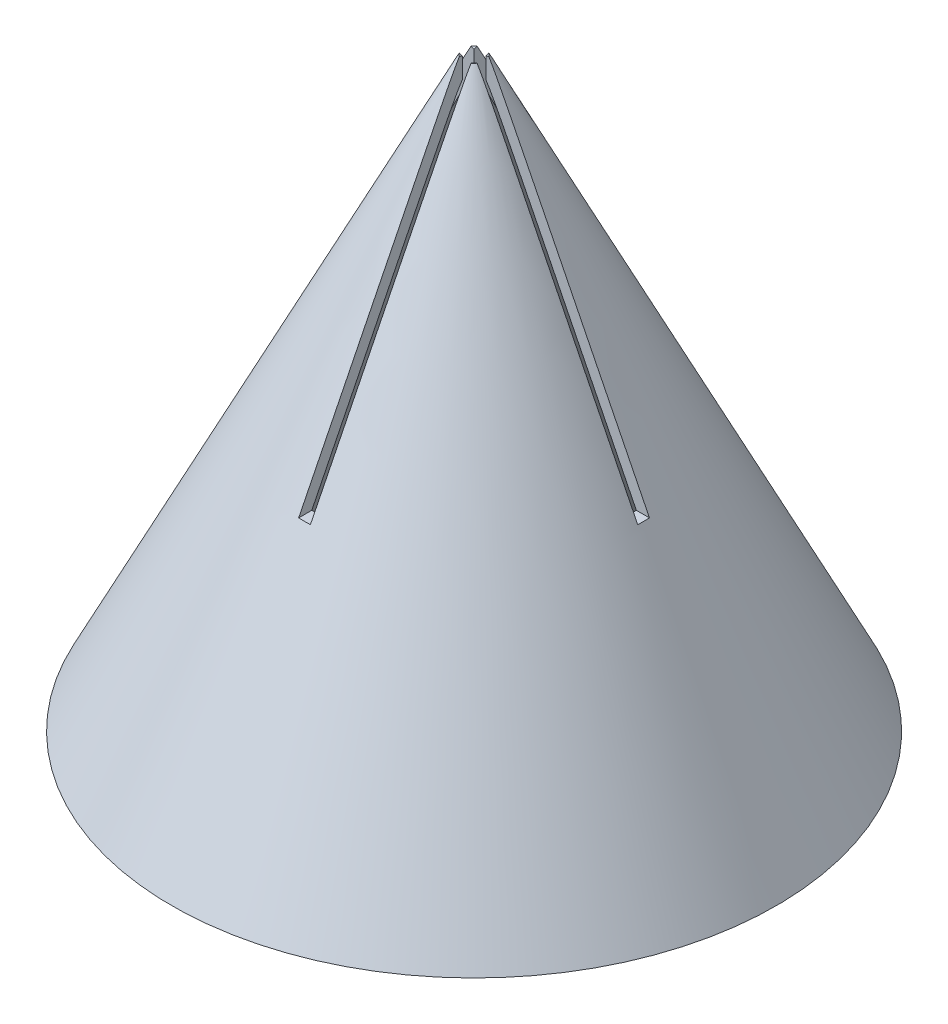
from build123d import *

# Parameters (mm, degrees)
CUT_EXTRUDE1_DEPTH = 23.5


with BuildPart() as part:
    # Sketch1 → Revolve1 (revolve)
    with BuildSketch(Plane.XY, mode=Mode.PRIVATE) as revolve1_sk:
        Polygon((-22.25, 0.384913229), (-0.783076171, 43.5), (-0.01, 43.115086771), (-21.476923829, 0), align=None)
    revolve(revolve1_sk.sketch.rotate(Axis((0, 0, 0), (0, 1, 0)), 270), axis=Axis((0, 0, 0), (0, 1, 0)))

    # Sketch3 → Cut-Extrude1 (cut)
    with BuildSketch(Plane(origin=(0, 43.5, 0), x_dir=(-1, 0, 0), z_dir=(0, -1, 0))):
        Polygon((-20.4318, -0.4318), (-20.4318, 0.4318), (-0.4318, 0.4318), (-0.4318, 20.4318), (0.4318, 20.4318), (0.4318, 0.4318), (20.4318, 0.4318), (20.4318, -0.4318), (0.4318, -0.4318), (0.4318, -20.4318), (-0.4318, -20.4318), (-0.4318, -0.4318), align=None)
    extrude(amount=CUT_EXTRUDE1_DEPTH, mode=Mode.SUBTRACT)


solid = part.part
